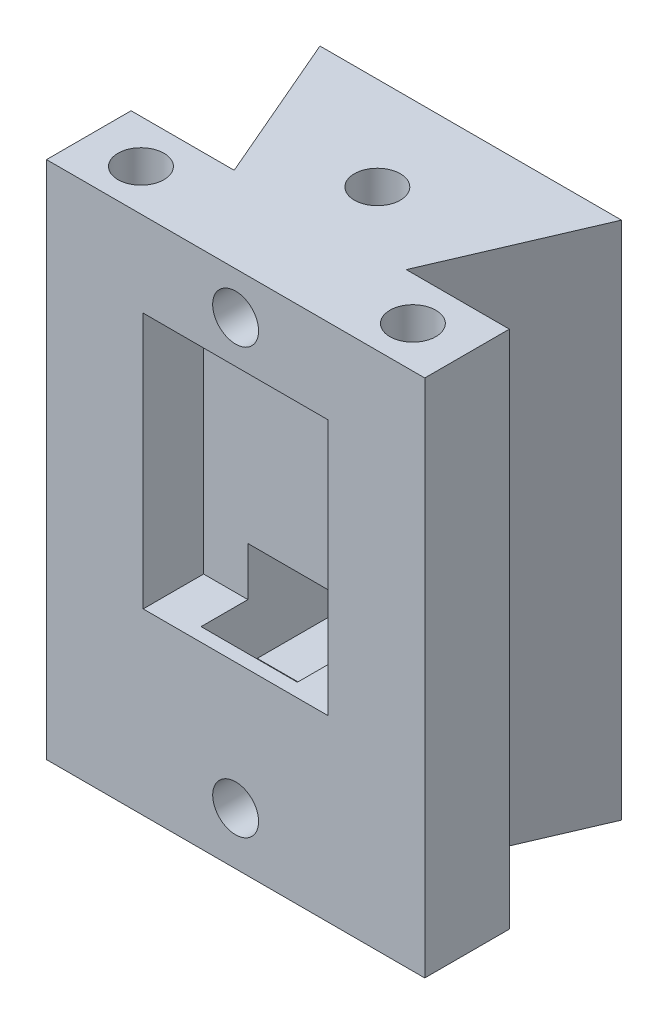
from build123d import *

# Parameters (mm, degrees)
SKETCH_2_W               = 31.3
SKETCH_2_H               = 34.2
SKETCH_2_W_2             = 15.3
SKETCH_2_H_2             = 21.2
EXTRUDE_1_DEPTH          = 7
SKETCH_2_3_W             = 15.3
SKETCH_2_3_H             = 21.2
EXTRUDE_2_DEPTH          = 2
SKETCH_5_W               = 7.971023584
SKETCH_5_H               = 4.648657004
CUT_EXTRUDE_2_DEPTH      = 7
CUT_EXTRUDE_3_DEPTH      = 39.256535389
CUT_EXTRUDE_3_DEPTH_BACK = 39.256535389
SKETCH_6_R               = 1.9
EXTRUDE_3_DEPTH          = 34.2
SKETCH_8_R               = 1.9
CUT_EXTRUDE_4_DEPTH      = 6
SKETCH_9_W               = 7.971023584
SKETCH_9_H               = 8.623939395
CUT_EXTRUDE_5_DEPTH      = 28.63322883
EXTRUDE_START            = 8.8
SKETCH_10_R              = 1.9
EXTRUDE_4_DEPTH          = 8.8
CUT_EXTRUDE_6_DEPTH      = 36.616478053
CUT_EXTRUDE_6_DEPTH_BACK = 8
SKETCH_11_R              = 1.9
CUT_EXTRUDE_7_DEPTH      = 48.423834368
CUT_EXTRUDE_7_DEPTH_BACK = 48.423834368
SKETCH_12_R              = 1.9


with BuildPart() as part:
    # 草图2 → 凸台-拉伸1 (new body)
    with BuildSketch(Plane.XY):
        with Locations((0, 0.5)):
            Rectangle(SKETCH_2_W, SKETCH_2_H)
        Rectangle(SKETCH_2_W_2, SKETCH_2_H_2, mode=Mode.SUBTRACT)
    extrude(amount=EXTRUDE_1_DEPTH)

    # 草图2<3> → 凸台-拉伸2 (add)
    with BuildSketch(Plane.XY):
        Rectangle(SKETCH_2_3_W, SKETCH_2_3_H)
    extrude(amount=EXTRUDE_2_DEPTH)

    # 草图5 → 切除-拉伸2 (cut)
    with BuildSketch(Plane(origin=(0, -10.6, 0), x_dir=(1, 0, 0), z_dir=(0, 1, 0))):
        with Locations((0, -3.548249301)):
            Rectangle(SKETCH_5_W, SKETCH_5_H)
    extrude(amount=-CUT_EXTRUDE_2_DEPTH, mode=Mode.SUBTRACT)

    # 草图6 → 切除-拉伸3 (cut, two sides: drawn at the far end of the back side and taken through both)
    with BuildSketch(Plane.XZ.offset(16.6).offset(-CUT_EXTRUDE_3_DEPTH_BACK)):
        with Locations((-11.25, 3.583357856)):
            Circle(SKETCH_6_R)
        with Locations(Location((11.25, 3.583357856, 0), (0, 0, 180))):
            Circle(SKETCH_6_R)
    extrude(amount=CUT_EXTRUDE_3_DEPTH + CUT_EXTRUDE_3_DEPTH_BACK, mode=Mode.SUBTRACT)

    # 草图7 → 凸台-拉伸3 (add)
    with BuildSketch(Plane.XZ.offset(16.6)):
        Polygon((7.118714005, 0), (-7.118714005, 0), (-12.476482967, -12.453817335), (12.476482967, -12.453817335), align=None)
    extrude(amount=-EXTRUDE_3_DEPTH)

    # 草图8 → 切除-拉伸4 (cut)
    with BuildSketch(Plane.XY.offset(7)):
        with Locations((0, 14.1)):
            Circle(SKETCH_8_R)
    extrude(amount=-CUT_EXTRUDE_4_DEPTH, mode=Mode.SUBTRACT)

    # 草图9 → 切除-拉伸5 (cut, through all)
    with BuildSketch(Plane.XY.offset(2)):
        with Locations((0, -10.888708642)):
            Rectangle(SKETCH_9_W, SKETCH_9_H)
    extrude(amount=-CUT_EXTRUDE_5_DEPTH, mode=Mode.SUBTRACT)

    # 草图10 → 凸台-拉伸4 (add)
    with BuildSketch(Plane.XZ.offset(16.6).offset(EXTRUDE_START)):
        Polygon((-15.65, 7), (-15.65, 0), (-7.118714005, 0), (-12.476482967, -12.453817335), (12.476482967, -12.453817335), (7.118714005, 0), (15.65, 0), (15.65, 7), align=None)
        with Locations((-11.25, 3.583357856)):
            Circle(SKETCH_10_R, mode=Mode.SUBTRACT)
        with Locations((11.25, 3.583357856)):
            Circle(SKETCH_10_R, mode=Mode.SUBTRACT)
    extrude(amount=-EXTRUDE_4_DEPTH)

    # 草图11 → 切除-拉伸6 (cut, two sides: drawn at the far end of the back side and taken through both)
    with BuildSketch(Plane.XY.offset(7).offset(-CUT_EXTRUDE_6_DEPTH_BACK)):
        with Locations(Location((0, -21.063101394, 0), (0, 0, 180))):
            Circle(SKETCH_11_R)
    extrude(amount=CUT_EXTRUDE_6_DEPTH + CUT_EXTRUDE_6_DEPTH_BACK, mode=Mode.SUBTRACT)

    # 草图12 → 切除-拉伸7 (cut, two sides: drawn at the far end of the back side and taken through both)
    with BuildSketch(Plane.XZ.offset(25.4).offset(-CUT_EXTRUDE_7_DEPTH_BACK)):
        with Locations((0, -4.727248667)):
            Circle(SKETCH_12_R)
    extrude(amount=CUT_EXTRUDE_7_DEPTH + CUT_EXTRUDE_7_DEPTH_BACK, mode=Mode.SUBTRACT)


solid = part.part
